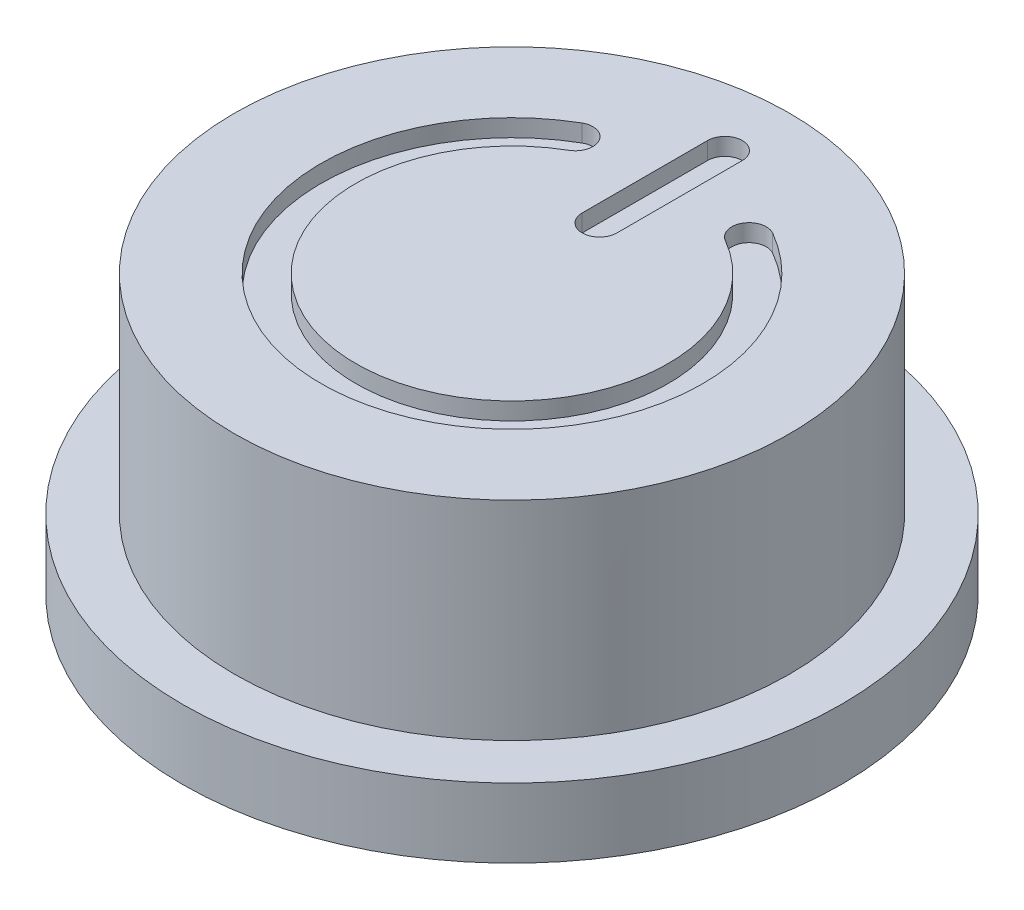
from build123d import *

# Parameters (mm, degrees)
SKETCH1_R           = 8
BOSS_EXTRUDE1_DEPTH = 6
SKETCH2_R           = 9.5
BOSS_EXTRUDE2_DEPTH = 2
SKETCH3_R           = 6.25
SKETCH3_R_2         = 4.25
CUT_EXTRUDE1_DEPTH  = 5
CHAMFER1_SIZE       = 1
CHAMFER2_SIZE       = 1
CUT_EXTRUDE2_DEPTH  = 16.636495771
CUT_EXTRUDE3_DEPTH  = 0.5


with BuildPart() as part:
    # Sketch1 → Boss-Extrude1 (new body)
    with BuildSketch(Plane(origin=(0, 0, 0), x_dir=(1, 0, 0), z_dir=(0, 1, 0))):
        with Locations(Location((0, 0, 0), (0, 0, 270))):
            Circle(SKETCH1_R)
    extrude(amount=BOSS_EXTRUDE1_DEPTH)

    # Sketch2 → Boss-Extrude2 (add)
    with BuildSketch(Plane.XZ):
        with Locations(Location((0, 0, 0), (0, 0, 270))):
            Circle(SKETCH2_R)
    extrude(amount=BOSS_EXTRUDE2_DEPTH)

    # Sketch3 → Cut-Extrude1 (cut)
    with BuildSketch(Plane.XZ.offset(2)):
        with Locations(Location((0, 0, 0), (0, 0, 270))):
            Circle(SKETCH3_R)
        with Locations(Location((0, 0, 0), (0, 0, 270))):
            Circle(SKETCH3_R_2, mode=Mode.SUBTRACT)
    extrude(amount=-CUT_EXTRUDE1_DEPTH, mode=Mode.SUBTRACT)

    # Chamfer1
    chamfer1_edges = [part.edges().sort_by_distance(p)[0] for p in [
        (0, -2, 6.25),
    ]]
    chamfer(chamfer1_edges, length=CHAMFER1_SIZE)

    # Chamfer2
    chamfer2_edges = [part.edges().sort_by_distance(p)[0] for p in [
        (0, -2, 4.25),
    ]]
    chamfer(chamfer2_edges, length=CHAMFER2_SIZE)

    # Sketch5 → Cut-Extrude2 (cut, through all)
    with BuildSketch(Plane.XZ.offset(2)):
        with BuildLine():
            Line((-1.25, -16.547716643), (1.25, -16.547716643))
            Line((1.25, -16.547716643), (1.25, -7.901740315))
            ThreePointArc((1.25, -7.901740315), (0, -8), (-1.25, -7.901740315))
            Line((-1.25, -7.901740315), (-1.25, -16.547716643))
        make_face()
    extrude(amount=-CUT_EXTRUDE2_DEPTH, mode=Mode.SUBTRACT)

    # Sketch6 → Cut-Extrude3 (cut)
    with BuildSketch(Plane(origin=(0, 6, 0), x_dir=(1, 0, 0), z_dir=(0, 1, 0))):
        with BuildLine():
            Line((0.5, 6.136828952), (0.5, 2.523425086))
            ThreePointArc((0.5, 2.523425086), (0, 2.023425086), (-0.5, 2.523425086))
            Line((-0.5, 2.523425086), (-0.5, 6.136828952))
            ThreePointArc((-0.5, 6.136828952), (0, 6.636828952), (0.5, 6.136828952))
        make_face()
        with BuildLine():
            ThreePointArc((-2.75, 4.763139721), (0, -5.5), (2.75, 4.763139721))
            ThreePointArc((2.75, 4.763139721), (2.066987298, 4.580127019), (2.25, 3.897114317))
            ThreePointArc((2.25, 3.897114317), (0, -4.5), (-2.25, 3.897114317))
            ThreePointArc((-2.25, 3.897114317), (-2.066987298, 4.580127019), (-2.75, 4.763139721))
        make_face()
    extrude(amount=-CUT_EXTRUDE3_DEPTH, mode=Mode.SUBTRACT)


solid = part.part
